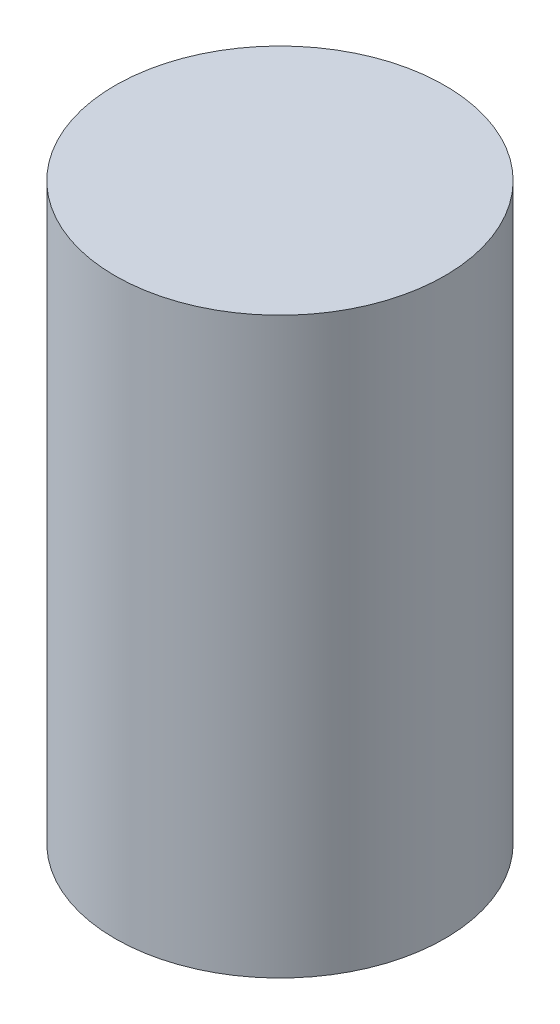
from build123d import *

# Parameters (mm, degrees)
SKETCH_1_R      = 15.8
EXTRUDE_1_DEPTH = 55


with BuildPart() as part:
    # 草图1 → 凸台-拉伸1 (new body)
    with BuildSketch(Plane(origin=(0, 0, 0), x_dir=(1, 0, 0), z_dir=(0, 1, 0))):
        with Locations(Location((0, 0, 0), (0, 0, 270))):
            Circle(SKETCH_1_R)
    extrude(amount=EXTRUDE_1_DEPTH)


solid = part.part
